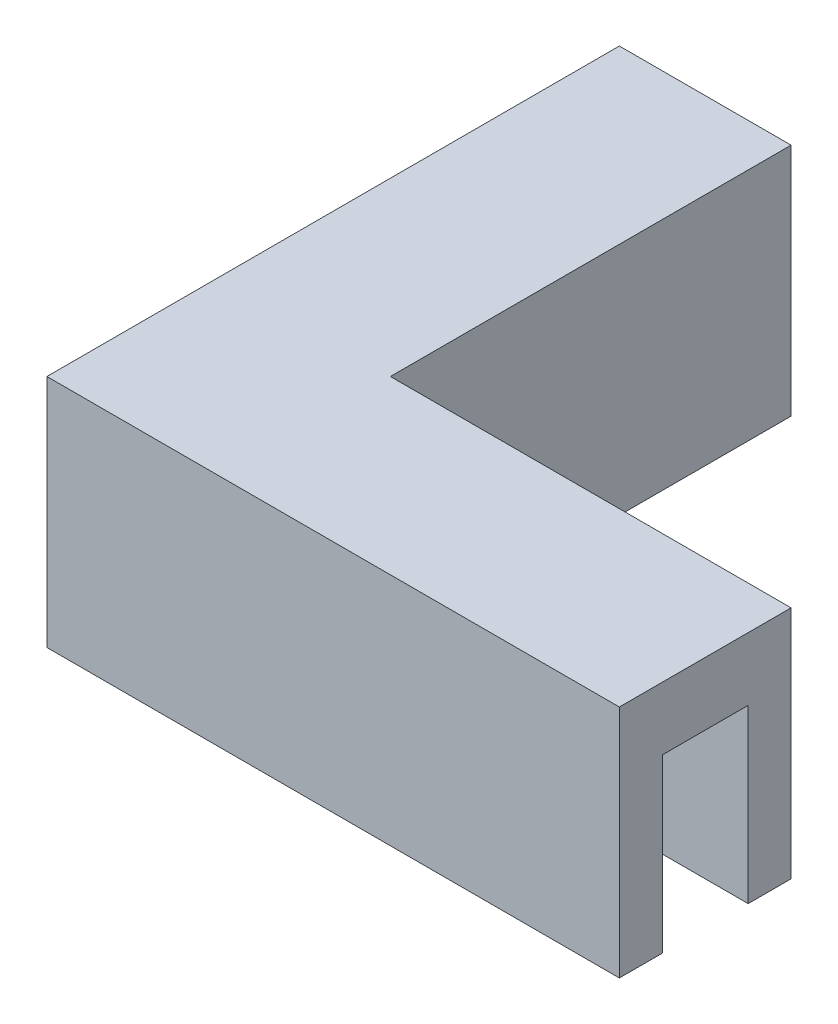
from build123d import *

# Parameters (mm, degrees)
BOSS_EXTRUDE1_DEPTH = 2.794
BOSS_EXTRUDE2_DEPTH = 7.62


with BuildPart() as part:
    # Sketch1 → Boss-Extrude1 (new body)
    with BuildSketch(Plane(origin=(0, 0, 0), x_dir=(1, 0, 0), z_dir=(0, 1, 0))):
        Polygon((0, 25.4), (0, 0), (25.4, 0), (25.4, 7.62), (7.62, 7.62), (7.62, 25.4), align=None)
    extrude(amount=BOSS_EXTRUDE1_DEPTH)

    # Sketch1<6> → Boss-Extrude2 (add)
    with BuildSketch(Plane(origin=(0, 0, 0), x_dir=(1, 0, 0), z_dir=(0, 1, 0))):
        Polygon((0, 25.4), (0, 0), (25.4, 0), (25.4, 1.905), (1.905, 1.905), (1.905, 25.4), align=None)
        Polygon((7.62, 25.4), (5.715, 25.4), (5.715, 5.715), (25.4, 5.715), (25.4, 7.62), (7.62, 7.62), align=None)
    extrude(amount=-BOSS_EXTRUDE2_DEPTH)


solid = part.part
